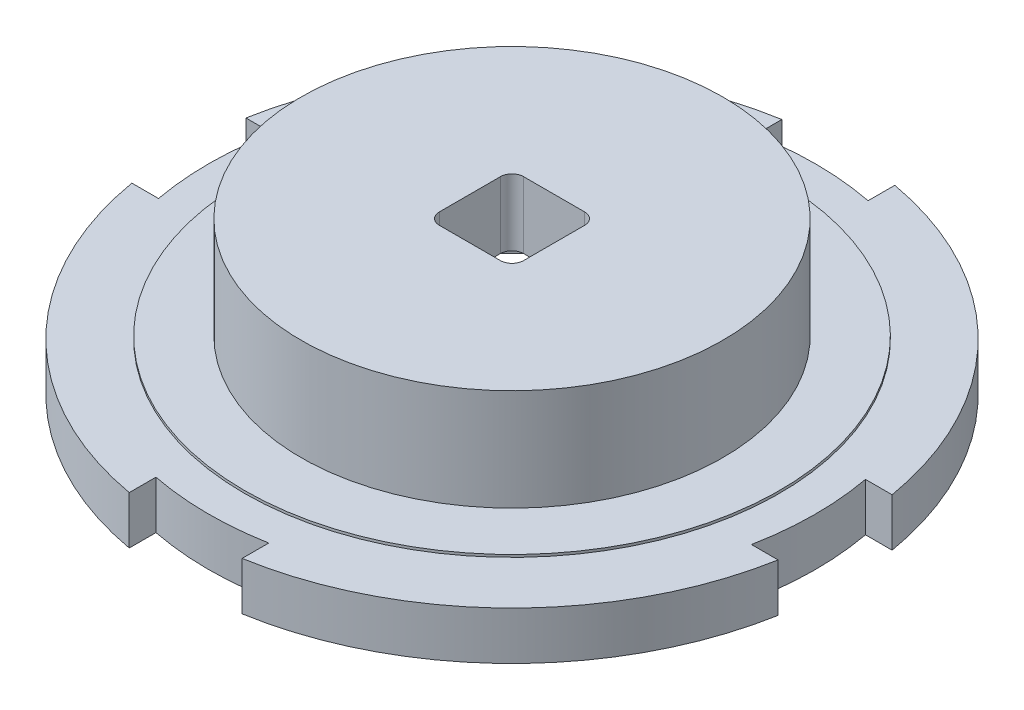
from build123d import *

# Parameters (mm, degrees)
SKETCH1_W           = 10
SKETCH1_H           = 10
BOSS_EXTRUDE2_DEPTH = 6
CUT_EXTRUDE1_DEPTH  = 3.81
SKETCH3_R           = 31.75
CUT_EXTRUDE2_DEPTH  = 0.3
SKETCH4_R           = 25.019
SKETCH4_W           = 10
SKETCH4_H           = 10
BOSS_EXTRUDE3_DEPTH = 12.065
SKETCH5_R           = 15.875
CUT_EXTRUDE3_DEPTH  = 6.35
FILLET1_R           = 1.3716
CUT_EXTRUDE4_START  = -0.3
SKETCH6_R           = 54.970137174
SKETCH6_R_2         = 31.75
CUT_EXTRUDE4_DEPTH  = 0.3


with BuildPart() as part:
    # Sketch1 → Boss-Extrude2 (new body)
    with BuildSketch(Plane(origin=(0, 0, 0), x_dir=(1, 0, 0), z_dir=(0, 1, 0))):
        with BuildLine():
            Line((35.405449863, 6.5405), (38.565312338, 6.5405))
            ThreePointArc((38.565312338, 6.5405), (27.795594479, 27.522107178), (6.9215, 38.498757042))
            Line((6.9215, 38.498757042), (6.9215, 35.332942957))
            ThreePointArc((6.9215, 35.332942957), (0.19391896, 36.003977776), (-6.5405, 35.405449863))
            Line((-6.5405, 35.405449863), (-6.5405, 38.565312338))
            ThreePointArc((-6.5405, 38.565312338), (-27.522107178, 27.795594479), (-38.498757042, 6.9215))
            Line((-38.498757042, 6.9215), (-35.332942957, 6.9215))
            ThreePointArc((-35.332942957, 6.9215), (-36.003977776, 0.19391896), (-35.405449863, -6.5405))
            Line((-35.405449863, -6.5405), (-38.565312338, -6.5405))
            ThreePointArc((-38.565312338, -6.5405), (-27.795594479, -27.522107178), (-6.9215, -38.498757042))
            Line((-6.9215, -38.498757042), (-6.9215, -35.332942957))
            ThreePointArc((-6.9215, -35.332942957), (-0.19391896, -36.003977776), (6.5405, -35.405449863))
            Line((6.5405, -35.405449863), (6.5405, -38.565312338))
            ThreePointArc((6.5405, -38.565312338), (27.522107178, -27.795594479), (38.498757042, -6.9215))
            Line((38.498757042, -6.9215), (35.332942957, -6.9215))
            ThreePointArc((35.332942957, -6.9215), (36.003977776, -0.19391896), (35.405449863, 6.5405))
        make_face()
        Rectangle(SKETCH1_W, SKETCH1_H, mode=Mode.SUBTRACT)
    extrude(amount=BOSS_EXTRUDE2_DEPTH)

    # Sketch2 → Cut-Extrude1 (cut)
    with BuildSketch(Plane.XZ):
        with BuildLine():
            Line((17.377665752, -10.033), (-0.286554615, -40.628327152))
            ThreePointArc((-0.286554615, -40.628327152), (-2.416432138, -40.557415308), (-4.539661745, -40.374924792))
            Line((-4.539661745, -40.374924792), (8.196212586, -18.315743371))
            ThreePointArc((8.196212586, -18.315743371), (-13.440862054, 14.899247741), (17.377665752, -10.033))
        make_face()
    extrude(amount=-CUT_EXTRUDE1_DEPTH, mode=Mode.SUBTRACT)

    # Sketch3 → Cut-Extrude2 (cut)
    with BuildSketch(Plane.XZ):
        Circle(SKETCH3_R)
    extrude(amount=-CUT_EXTRUDE2_DEPTH, mode=Mode.SUBTRACT)

    # Sketch4 → Boss-Extrude3 (add)
    with BuildSketch(Plane(origin=(0, 6, 0), x_dir=(1, 0, 0), z_dir=(0, 1, 0))):
        with Locations(Location((0, 0, 0), (0, 0, 90))):
            Circle(SKETCH4_R)
        Rectangle(SKETCH4_W, SKETCH4_H, mode=Mode.SUBTRACT)
    extrude(amount=BOSS_EXTRUDE3_DEPTH)

    # Sketch5 → Cut-Extrude3 (cut)
    with BuildSketch(Plane.XZ.offset(-3.81)):
        with Locations(Location((0, 0, 0), (0, 0, 270))):
            Circle(SKETCH5_R)
    extrude(amount=-CUT_EXTRUDE3_DEPTH, mode=Mode.SUBTRACT)

    # Fillet1
    fillet1_edges = [part.edges().sort_by_distance(p)[0] for p in [
        (5, 14.1125, -5),
        (-5, 14.1125, -5),
        (-5, 14.1125, 5),
        (5, 14.1125, 5),
    ]]
    fillet(fillet1_edges, radius=FILLET1_R)

    # Sketch6 → Cut-Extrude4 (cut)
    with BuildSketch(Plane(origin=(0, 6, 0), x_dir=(1, 0, 0), z_dir=(0, 1, 0)).offset(CUT_EXTRUDE4_START)):
        Circle(SKETCH6_R)
        with Locations(Location((0, 0, 0), (0, 0, 270))):
            Circle(SKETCH6_R_2, mode=Mode.SUBTRACT)
    extrude(amount=CUT_EXTRUDE4_DEPTH, mode=Mode.SUBTRACT)


solid = part.part
